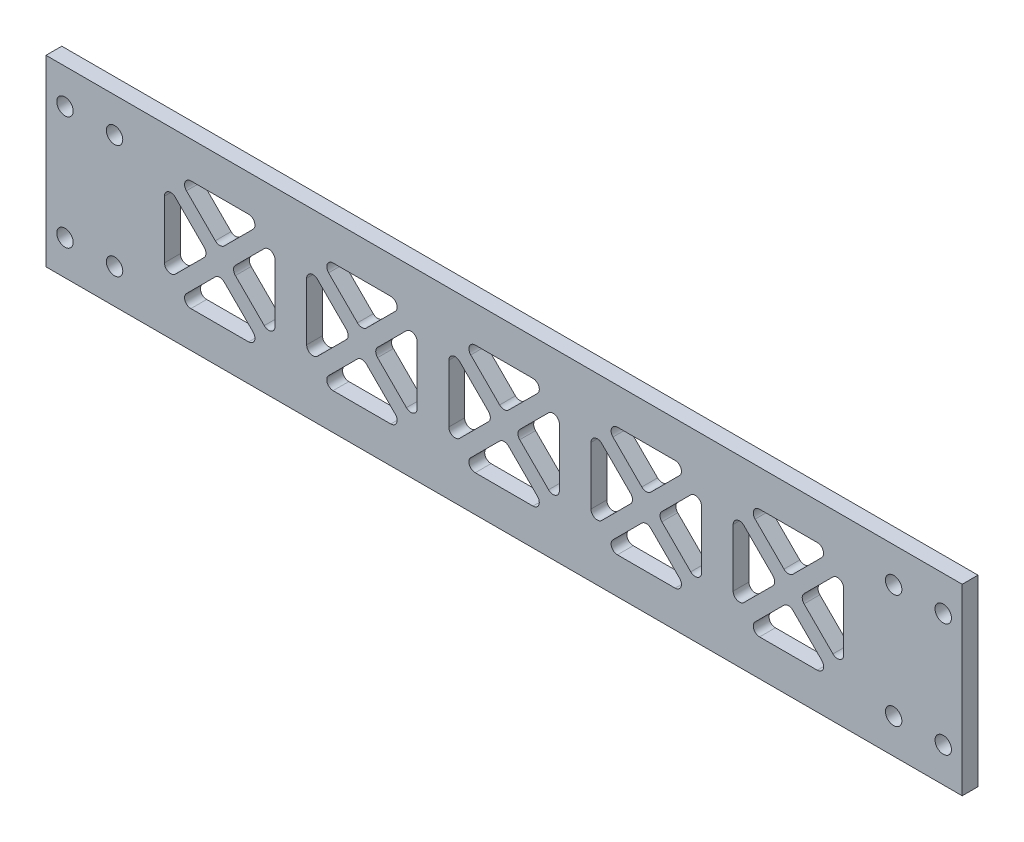
from build123d import *

# Parameters (mm, degrees)
SKETCH_1_W          = 290
SKETCH_1_H          = 58
EXTRUDE_1_DEPTH     = 5
SKETCH_2_W          = 5
SKETCH_2_H          = 28
EXTRUDE_2_DEPTH     = 5
SKETCH_4_R          = 1
SKETCH_4_W          = 5
SKETCH_4_H          = 28
CUT_EXTRUDE_2_DEPTH = 5
SKETCH_5_R          = 2.6
CUT_EXTRUDE_3_DEPTH = 301.68920832
EXTRUDE_3_DEPTH     = 5
CUT_EXTRUDE_5_DEPTH = 10
SKETCH_9_W          = 5
SKETCH_9_H          = 28
CUT_EXTRUDE_6_DEPTH = 10


with BuildPart() as part:
    # 草图1 → 凸台-拉伸1 (new body)
    with BuildSketch(Plane.XY):
        with Locations((145, -29)):
            Rectangle(SKETCH_1_W, SKETCH_1_H)
    extrude(amount=EXTRUDE_1_DEPTH)

    # 草图2 → 凸台-拉伸2 (add)
    with BuildSketch(Plane.XY.offset(5)):
        with Locations((292.5, -29)):
            Rectangle(SKETCH_2_W, SKETCH_2_H)
        with Locations((-2.5, -29)):
            Rectangle(SKETCH_2_W, SKETCH_2_H)
    extrude(amount=-EXTRUDE_2_DEPTH)

    # 草图4 → 切除-拉伸2 (cut)
    with BuildSketch(Plane(origin=(0, 0, 0), x_dir=(-1, 0, 0), z_dir=(0, 0, -1))):
        with BuildLine():
            Line((-262.3, -16), (-262.3, -15))
            Line((-262.3, -15), (-261.3, -15))
            ThreePointArc((-261.3, -15), (-263.007106781, -14.292893219), (-262.3, -16))
        make_face()
        with BuildLine():
            Line((-261.3, -15), (-262.3, -15))
            Line((-262.3, -15), (-262.3, -16))
            ThreePointArc((-262.3, -16), (-261.592893219, -15.707106781), (-261.3, -15))
        make_face()
        with BuildLine():
            Line((-262.3, -16), (-262.3, -15))
            Line((-262.3, -15), (-261.3, -15))
            ThreePointArc((-261.3, -15), (-263.007106781, -14.292893219), (-262.3, -16))
        make_face()
        with BuildLine():
            Line((-261.3, -15), (-262.3, -15))
            Line((-262.3, -15), (-262.3, -16))
            ThreePointArc((-262.3, -16), (-261.592893219, -15.707106781), (-261.3, -15))
        make_face()
        with Locations((-257.3, -43)):
            Circle(SKETCH_4_R)
        with Locations((-257.3, -15)):
            Circle(SKETCH_4_R)
        with Locations((-262.3, -15)):
            Circle(SKETCH_4_R)
        with Locations((-262.3, -43)):
            Circle(SKETCH_4_R)
        with Locations((-259.8, -29)):
            Rectangle(SKETCH_4_W, SKETCH_4_H)
        with BuildLine():
            ThreePointArc((-256.3, -15), (-257.3, -14), (-258.3, -15))
            Line((-258.3, -15), (-257.3, -15))
            Line((-257.3, -15), (-257.3, -16))
            ThreePointArc((-257.3, -16), (-256.592893219, -15.707106781), (-256.3, -15))
        make_face()
        with BuildLine():
            Line((-257.3, -15), (-258.3, -15))
            ThreePointArc((-258.3, -15), (-258.007106781, -15.707106781), (-257.3, -16))
            Line((-257.3, -16), (-257.3, -15))
        make_face()
        with BuildLine():
            ThreePointArc((-256.3, -15), (-257.3, -14), (-258.3, -15))
            Line((-258.3, -15), (-257.3, -15))
            Line((-257.3, -15), (-257.3, -16))
            ThreePointArc((-257.3, -16), (-256.592893219, -15.707106781), (-256.3, -15))
        make_face()
        with BuildLine():
            Line((-257.3, -15), (-258.3, -15))
            ThreePointArc((-258.3, -15), (-258.007106781, -15.707106781), (-257.3, -16))
            Line((-257.3, -16), (-257.3, -15))
        make_face()
        with BuildLine():
            ThreePointArc((-261.3, -43), (-261.592893219, -42.292893219), (-262.3, -42))
            Line((-262.3, -42), (-262.3, -43))
            Line((-262.3, -43), (-261.3, -43))
        make_face()
        with BuildLine():
            Line((-262.3, -43), (-262.3, -42))
            ThreePointArc((-262.3, -42), (-263.007106781, -43.707106781), (-261.3, -43))
            Line((-261.3, -43), (-262.3, -43))
        make_face()
        with BuildLine():
            ThreePointArc((-261.3, -43), (-261.592893219, -42.292893219), (-262.3, -42))
            Line((-262.3, -42), (-262.3, -43))
            Line((-262.3, -43), (-261.3, -43))
        make_face()
        with BuildLine():
            Line((-262.3, -43), (-262.3, -42))
            ThreePointArc((-262.3, -42), (-263.007106781, -43.707106781), (-261.3, -43))
            Line((-261.3, -43), (-262.3, -43))
        make_face()
        with BuildLine():
            ThreePointArc((-256.3, -43), (-256.592893219, -42.292893219), (-257.3, -42))
            Line((-257.3, -42), (-257.3, -43))
            Line((-257.3, -43), (-258.3, -43))
            ThreePointArc((-258.3, -43), (-257.3, -44), (-256.3, -43))
        make_face()
        with BuildLine():
            Line((-257.3, -43), (-257.3, -42))
            ThreePointArc((-257.3, -42), (-258.007106781, -42.292893219), (-258.3, -43))
            Line((-258.3, -43), (-257.3, -43))
        make_face()
        with BuildLine():
            ThreePointArc((-256.3, -43), (-256.592893219, -42.292893219), (-257.3, -42))
            Line((-257.3, -42), (-257.3, -43))
            Line((-257.3, -43), (-258.3, -43))
            ThreePointArc((-258.3, -43), (-257.3, -44), (-256.3, -43))
        make_face()
        with BuildLine():
            Line((-257.3, -43), (-257.3, -42))
            ThreePointArc((-257.3, -42), (-258.007106781, -42.292893219), (-258.3, -43))
            Line((-258.3, -43), (-257.3, -43))
        make_face()
        with BuildLine():
            ThreePointArc((-31.7, -15), (-33.407106781, -14.292893219), (-32.7, -16))
            Line((-32.7, -16), (-32.7, -15))
            Line((-32.7, -15), (-31.7, -15))
        make_face()
        with BuildLine():
            Line((-32.7, -15), (-32.7, -16))
            ThreePointArc((-32.7, -16), (-31.992893219, -15.707106781), (-31.7, -15))
            Line((-31.7, -15), (-32.7, -15))
        make_face()
        with BuildLine():
            ThreePointArc((-31.7, -15), (-33.407106781, -14.292893219), (-32.7, -16))
            Line((-32.7, -16), (-32.7, -15))
            Line((-32.7, -15), (-31.7, -15))
        make_face()
        with BuildLine():
            Line((-32.7, -15), (-32.7, -16))
            ThreePointArc((-32.7, -16), (-31.992893219, -15.707106781), (-31.7, -15))
            Line((-31.7, -15), (-32.7, -15))
        make_face()
        with Locations((-27.7, -43)):
            Circle(SKETCH_4_R)
        with Locations((-27.7, -15)):
            Circle(SKETCH_4_R)
        with Locations((-32.7, -15)):
            Circle(SKETCH_4_R)
        with Locations((-32.7, -43)):
            Circle(SKETCH_4_R)
        with Locations((-30.2, -29)):
            Rectangle(SKETCH_4_W, SKETCH_4_H)
        with BuildLine():
            ThreePointArc((-28.7, -15), (-28.407106781, -15.707106781), (-27.7, -16))
            Line((-27.7, -16), (-27.7, -15))
            Line((-27.7, -15), (-28.7, -15))
        make_face()
        with BuildLine():
            Line((-27.7, -15), (-27.7, -16))
            ThreePointArc((-27.7, -16), (-26.992893219, -15.707106781), (-26.7, -15))
            ThreePointArc((-26.7, -15), (-27.7, -14), (-28.7, -15))
            Line((-28.7, -15), (-27.7, -15))
        make_face()
        with BuildLine():
            ThreePointArc((-28.7, -15), (-28.407106781, -15.707106781), (-27.7, -16))
            Line((-27.7, -16), (-27.7, -15))
            Line((-27.7, -15), (-28.7, -15))
        make_face()
        with BuildLine():
            Line((-27.7, -15), (-27.7, -16))
            ThreePointArc((-27.7, -16), (-26.992893219, -15.707106781), (-26.7, -15))
            ThreePointArc((-26.7, -15), (-27.7, -14), (-28.7, -15))
            Line((-28.7, -15), (-27.7, -15))
        make_face()
        with BuildLine():
            ThreePointArc((-32.7, -42), (-33.407106781, -43.707106781), (-31.7, -43))
            Line((-31.7, -43), (-32.7, -43))
            Line((-32.7, -43), (-32.7, -42))
        make_face()
        with BuildLine():
            Line((-32.7, -43), (-31.7, -43))
            ThreePointArc((-31.7, -43), (-31.992893219, -42.292893219), (-32.7, -42))
            Line((-32.7, -42), (-32.7, -43))
        make_face()
        with BuildLine():
            ThreePointArc((-32.7, -42), (-33.407106781, -43.707106781), (-31.7, -43))
            Line((-31.7, -43), (-32.7, -43))
            Line((-32.7, -43), (-32.7, -42))
        make_face()
        with BuildLine():
            Line((-32.7, -43), (-31.7, -43))
            ThreePointArc((-31.7, -43), (-31.992893219, -42.292893219), (-32.7, -42))
            Line((-32.7, -42), (-32.7, -43))
        make_face()
        with BuildLine():
            ThreePointArc((-27.7, -42), (-28.407106781, -42.292893219), (-28.7, -43))
            Line((-28.7, -43), (-27.7, -43))
            Line((-27.7, -43), (-27.7, -42))
        make_face()
        with BuildLine():
            Line((-27.7, -43), (-28.7, -43))
            ThreePointArc((-28.7, -43), (-27.7, -44), (-26.7, -43))
            ThreePointArc((-26.7, -43), (-26.992893219, -42.292893219), (-27.7, -42))
            Line((-27.7, -42), (-27.7, -43))
        make_face()
        with BuildLine():
            ThreePointArc((-27.7, -42), (-28.407106781, -42.292893219), (-28.7, -43))
            Line((-28.7, -43), (-27.7, -43))
            Line((-27.7, -43), (-27.7, -42))
        make_face()
        with BuildLine():
            Line((-27.7, -43), (-28.7, -43))
            ThreePointArc((-28.7, -43), (-27.7, -44), (-26.7, -43))
            ThreePointArc((-26.7, -43), (-26.992893219, -42.292893219), (-27.7, -42))
            Line((-27.7, -42), (-27.7, -43))
        make_face()
    extrude(amount=-CUT_EXTRUDE_2_DEPTH, mode=Mode.SUBTRACT)

    # 草图5 → 切除-拉伸3 (cut, through all)
    with BuildSketch(Plane.XY.offset(5)):
        with Locations((6, -11)):
            Circle(SKETCH_5_R)
        with Locations((21.7, -11)):
            Circle(SKETCH_5_R)
        with Locations((6, -47)):
            Circle(SKETCH_5_R)
        with Locations((21.7, -47)):
            Circle(SKETCH_5_R)
        with Locations((268.3, -11)):
            Circle(SKETCH_5_R)
        with Locations((284, -11)):
            Circle(SKETCH_5_R)
        with Locations((268.3, -47)):
            Circle(SKETCH_5_R)
        with Locations((284, -47)):
            Circle(SKETCH_5_R)
    extrude(amount=-CUT_EXTRUDE_3_DEPTH, mode=Mode.SUBTRACT)

    # 草图6 → 凸台-拉伸3 (add, through all)
    with BuildSketch(Plane.XY.offset(5)):
        with BuildLine():
            Line((31.7, -15), (28.7, -15))
            ThreePointArc((28.7, -15), (26.992893219, -14.292893219), (27.7, -16))
            Line((27.7, -16), (27.7, -42))
            ThreePointArc((27.7, -42), (26.992893219, -43.707106781), (28.7, -43))
            Line((28.7, -43), (31.7, -43))
            ThreePointArc((31.7, -43), (33.407106781, -43.707106781), (32.7, -42))
            Line((32.7, -42), (32.7, -16))
            ThreePointArc((32.7, -16), (33.407106781, -14.292893219), (31.7, -15))
        make_face()
        with BuildLine():
            Line((258.3, -43), (261.3, -43))
            ThreePointArc((261.3, -43), (263.007106781, -43.707106781), (262.3, -42))
            Line((262.3, -42), (262.3, -16))
            ThreePointArc((262.3, -16), (263.007106781, -14.292893219), (261.3, -15))
            Line((261.3, -15), (258.3, -15))
            ThreePointArc((258.3, -15), (256.592893219, -14.292893219), (257.3, -16))
            Line((257.3, -16), (257.3, -42))
            ThreePointArc((257.3, -42), (256.592893219, -43.707106781), (258.3, -43))
        make_face()
    extrude(amount=-EXTRUDE_3_DEPTH)

    # 草图8 → 切除-拉伸5 (cut)
    with BuildSketch(Plane.XY.offset(5)):
        with BuildLine():
            ThreePointArc((44.449747468, -14.914213562), (44.016201966, -12.734633135), (45.863961031, -11.5))
            Line((45.863961031, -11.5), (64.136038969, -11.5))
            ThreePointArc((64.136038969, -11.5), (65.983798034, -12.734633135), (65.550252532, -14.914213562))
            Line((65.550252532, -14.914213562), (56.414213562, -24.050252532))
            ThreePointArc((56.414213562, -24.050252532), (55, -24.636038969), (53.585786438, -24.050252532))
            Line((53.585786438, -24.050252532), (44.449747468, -14.914213562))
        make_face()
        with BuildLine():
            Line((50.050252532, -30.414213562), (40.914213562, -39.550252532))
            ThreePointArc((40.914213562, -39.550252532), (38.734633135, -39.983798034), (37.5, -38.136038969))
            Line((37.5, -38.136038969), (37.5, -19.863961031))
            ThreePointArc((37.5, -19.863961031), (38.734633135, -18.016201966), (40.914213562, -18.449747468))
            Line((40.914213562, -18.449747468), (50.050252532, -27.585786438))
            ThreePointArc((50.050252532, -27.585786438), (50.636038969, -29), (50.050252532, -30.414213562))
        make_face()
        with BuildLine():
            Line((59.949747468, -27.585786438), (69.085786438, -18.449747468))
            ThreePointArc((69.085786438, -18.449747468), (71.265366865, -18.016201966), (72.5, -19.863961031))
            Line((72.5, -19.863961031), (72.5, -38.136038969))
            ThreePointArc((72.5, -38.136038969), (71.265366865, -39.983798034), (69.085786438, -39.550252532))
            Line((69.085786438, -39.550252532), (59.949747468, -30.414213562))
            ThreePointArc((59.949747468, -30.414213562), (59.363961031, -29), (59.949747468, -27.585786438))
        make_face()
        with BuildLine():
            Line((56.414213562, -33.949747468), (65.550252532, -43.085786438))
            ThreePointArc((65.550252532, -43.085786438), (65.983798034, -45.265366865), (64.136038969, -46.5))
            Line((64.136038969, -46.5), (45.863961031, -46.5))
            ThreePointArc((45.863961031, -46.5), (44.016201966, -45.265366865), (44.449747468, -43.085786438))
            Line((44.449747468, -43.085786438), (53.585786438, -33.949747468))
            ThreePointArc((53.585786438, -33.949747468), (55, -33.363961031), (56.414213562, -33.949747468))
        make_face()
        with BuildLine():
            ThreePointArc((110.550252532, -43.085786438), (110.983798034, -45.265366865), (109.136038969, -46.5))
            Line((109.136038969, -46.5), (90.863961031, -46.5))
            ThreePointArc((90.863961031, -46.5), (89.016201966, -45.265366865), (89.449747468, -43.085786438))
            Line((89.449747468, -43.085786438), (98.585786438, -33.949747468))
            ThreePointArc((98.585786438, -33.949747468), (100, -33.363961031), (101.414213562, -33.949747468))
            Line((101.414213562, -33.949747468), (110.550252532, -43.085786438))
        make_face()
        with BuildLine():
            ThreePointArc((85.914213562, -39.550252532), (83.734633135, -39.983798034), (82.5, -38.136038969))
            Line((82.5, -38.136038969), (82.5, -19.863961031))
            ThreePointArc((82.5, -19.863961031), (83.734633135, -18.016201966), (85.914213562, -18.449747468))
            Line((85.914213562, -18.449747468), (95.050252532, -27.585786438))
            ThreePointArc((95.050252532, -27.585786438), (95.636038969, -29), (95.050252532, -30.414213562))
            Line((95.050252532, -30.414213562), (85.914213562, -39.550252532))
        make_face()
        with BuildLine():
            Line((98.585786438, -24.050252532), (89.449747468, -14.914213562))
            ThreePointArc((89.449747468, -14.914213562), (89.016201966, -12.734633135), (90.863961031, -11.5))
            Line((90.863961031, -11.5), (109.136038969, -11.5))
            ThreePointArc((109.136038969, -11.5), (110.983798034, -12.734633135), (110.550252532, -14.914213562))
            Line((110.550252532, -14.914213562), (101.414213562, -24.050252532))
            ThreePointArc((101.414213562, -24.050252532), (100, -24.636038969), (98.585786438, -24.050252532))
        make_face()
        with BuildLine():
            ThreePointArc((114.085786438, -18.449747468), (116.265366865, -18.016201966), (117.5, -19.863961031))
            Line((117.5, -19.863961031), (117.5, -38.136038969))
            ThreePointArc((117.5, -38.136038969), (116.265366865, -39.983798034), (114.085786438, -39.550252532))
            Line((114.085786438, -39.550252532), (104.949747468, -30.414213562))
            ThreePointArc((104.949747468, -30.414213562), (104.363961031, -29), (104.949747468, -27.585786438))
            Line((104.949747468, -27.585786438), (114.085786438, -18.449747468))
        make_face()
        with BuildLine():
            ThreePointArc((130.914213562, -39.550252532), (128.734633135, -39.983798034), (127.5, -38.136038969))
            Line((127.5, -38.136038969), (127.5, -19.863961031))
            ThreePointArc((127.5, -19.863961031), (128.734633135, -18.016201966), (130.914213562, -18.449747468))
            Line((130.914213562, -18.449747468), (140.050252532, -27.585786438))
            ThreePointArc((140.050252532, -27.585786438), (140.636038969, -29), (140.050252532, -30.414213562))
            Line((140.050252532, -30.414213562), (130.914213562, -39.550252532))
        make_face()
        with BuildLine():
            Line((143.585786438, -24.050252532), (134.449747468, -14.914213562))
            ThreePointArc((134.449747468, -14.914213562), (134.016201966, -12.734633135), (135.863961031, -11.5))
            Line((135.863961031, -11.5), (154.136038969, -11.5))
            ThreePointArc((154.136038969, -11.5), (155.983798034, -12.734633135), (155.550252532, -14.914213562))
            Line((155.550252532, -14.914213562), (146.414213562, -24.050252532))
            ThreePointArc((146.414213562, -24.050252532), (145, -24.636038969), (143.585786438, -24.050252532))
        make_face()
        with BuildLine():
            ThreePointArc((159.085786438, -18.449747468), (161.265366865, -18.016201966), (162.5, -19.863961031))
            Line((162.5, -19.863961031), (162.5, -38.136038969))
            ThreePointArc((162.5, -38.136038969), (161.265366865, -39.983798034), (159.085786438, -39.550252532))
            Line((159.085786438, -39.550252532), (149.949747468, -30.414213562))
            ThreePointArc((149.949747468, -30.414213562), (149.363961031, -29), (149.949747468, -27.585786438))
            Line((149.949747468, -27.585786438), (159.085786438, -18.449747468))
        make_face()
        with BuildLine():
            ThreePointArc((155.550252532, -43.085786438), (155.983798034, -45.265366865), (154.136038969, -46.5))
            Line((154.136038969, -46.5), (135.863961031, -46.5))
            ThreePointArc((135.863961031, -46.5), (134.016201966, -45.265366865), (134.449747468, -43.085786438))
            Line((134.449747468, -43.085786438), (143.585786438, -33.949747468))
            ThreePointArc((143.585786438, -33.949747468), (145, -33.363961031), (146.414213562, -33.949747468))
            Line((146.414213562, -33.949747468), (155.550252532, -43.085786438))
        make_face()
        with BuildLine():
            Line((188.585786438, -24.050252532), (179.449747468, -14.914213562))
            ThreePointArc((179.449747468, -14.914213562), (179.016201966, -12.734633135), (180.863961031, -11.5))
            Line((180.863961031, -11.5), (199.136038969, -11.5))
            ThreePointArc((199.136038969, -11.5), (200.983798034, -12.734633135), (200.550252532, -14.914213562))
            Line((200.550252532, -14.914213562), (191.414213562, -24.050252532))
            ThreePointArc((191.414213562, -24.050252532), (190, -24.636038969), (188.585786438, -24.050252532))
        make_face()
        with BuildLine():
            ThreePointArc((175.914213562, -39.550252532), (173.734633135, -39.983798034), (172.5, -38.136038969))
            Line((172.5, -38.136038969), (172.5, -19.863961031))
            ThreePointArc((172.5, -19.863961031), (173.734633135, -18.016201966), (175.914213562, -18.449747468))
            Line((175.914213562, -18.449747468), (185.050252532, -27.585786438))
            ThreePointArc((185.050252532, -27.585786438), (185.636038969, -29), (185.050252532, -30.414213562))
            Line((185.050252532, -30.414213562), (175.914213562, -39.550252532))
        make_face()
        with BuildLine():
            ThreePointArc((204.085786438, -18.449747468), (206.265366865, -18.016201966), (207.5, -19.863961031))
            Line((207.5, -19.863961031), (207.5, -38.136038969))
            ThreePointArc((207.5, -38.136038969), (206.265366865, -39.983798034), (204.085786438, -39.550252532))
            Line((204.085786438, -39.550252532), (194.949747468, -30.414213562))
            ThreePointArc((194.949747468, -30.414213562), (194.363961031, -29), (194.949747468, -27.585786438))
            Line((194.949747468, -27.585786438), (204.085786438, -18.449747468))
        make_face()
        with BuildLine():
            ThreePointArc((200.550252532, -43.085786438), (200.983798034, -45.265366865), (199.136038969, -46.5))
            Line((199.136038969, -46.5), (180.863961031, -46.5))
            ThreePointArc((180.863961031, -46.5), (179.016201966, -45.265366865), (179.449747468, -43.085786438))
            Line((179.449747468, -43.085786438), (188.585786438, -33.949747468))
            ThreePointArc((188.585786438, -33.949747468), (190, -33.363961031), (191.414213562, -33.949747468))
            Line((191.414213562, -33.949747468), (200.550252532, -43.085786438))
        make_face()
        with BuildLine():
            ThreePointArc((220.914213562, -39.550252532), (218.734633135, -39.983798034), (217.5, -38.136038969))
            Line((217.5, -38.136038969), (217.5, -19.863961031))
            ThreePointArc((217.5, -19.863961031), (218.734633135, -18.016201966), (220.914213562, -18.449747468))
            Line((220.914213562, -18.449747468), (230.050252532, -27.585786438))
            ThreePointArc((230.050252532, -27.585786438), (230.636038969, -29), (230.050252532, -30.414213562))
            Line((230.050252532, -30.414213562), (220.914213562, -39.550252532))
        make_face()
        with BuildLine():
            Line((233.585786438, -24.050252532), (224.449747468, -14.914213562))
            ThreePointArc((224.449747468, -14.914213562), (224.016201966, -12.734633135), (225.863961031, -11.5))
            Line((225.863961031, -11.5), (244.136038969, -11.5))
            ThreePointArc((244.136038969, -11.5), (245.983798034, -12.734633135), (245.550252532, -14.914213562))
            Line((245.550252532, -14.914213562), (236.414213562, -24.050252532))
            ThreePointArc((236.414213562, -24.050252532), (235, -24.636038969), (233.585786438, -24.050252532))
        make_face()
        with BuildLine():
            ThreePointArc((249.085786438, -18.449747468), (251.265366865, -18.016201966), (252.5, -19.863961031))
            Line((252.5, -19.863961031), (252.5, -38.136038969))
            ThreePointArc((252.5, -38.136038969), (251.265366865, -39.983798034), (249.085786438, -39.550252532))
            Line((249.085786438, -39.550252532), (239.949747468, -30.414213562))
            ThreePointArc((239.949747468, -30.414213562), (239.363961031, -29), (239.949747468, -27.585786438))
            Line((239.949747468, -27.585786438), (249.085786438, -18.449747468))
        make_face()
        with BuildLine():
            ThreePointArc((245.550252532, -43.085786438), (245.983798034, -45.265366865), (244.136038969, -46.5))
            Line((244.136038969, -46.5), (225.863961031, -46.5))
            ThreePointArc((225.863961031, -46.5), (224.016201966, -45.265366865), (224.449747468, -43.085786438))
            Line((224.449747468, -43.085786438), (233.585786438, -33.949747468))
            ThreePointArc((233.585786438, -33.949747468), (235, -33.363961031), (236.414213562, -33.949747468))
            Line((236.414213562, -33.949747468), (245.550252532, -43.085786438))
        make_face()
    extrude(amount=-CUT_EXTRUDE_5_DEPTH, mode=Mode.SUBTRACT)

    # 草图9 → 切除-拉伸6 (cut)
    with BuildSketch(Plane.XY.offset(5)):
        with Locations((-2.5, -29)):
            Rectangle(SKETCH_9_W, SKETCH_9_H)
        with Locations((292.5, -29)):
            Rectangle(SKETCH_9_W, SKETCH_9_H)
    extrude(amount=-CUT_EXTRUDE_6_DEPTH, mode=Mode.SUBTRACT)


solid = part.part
